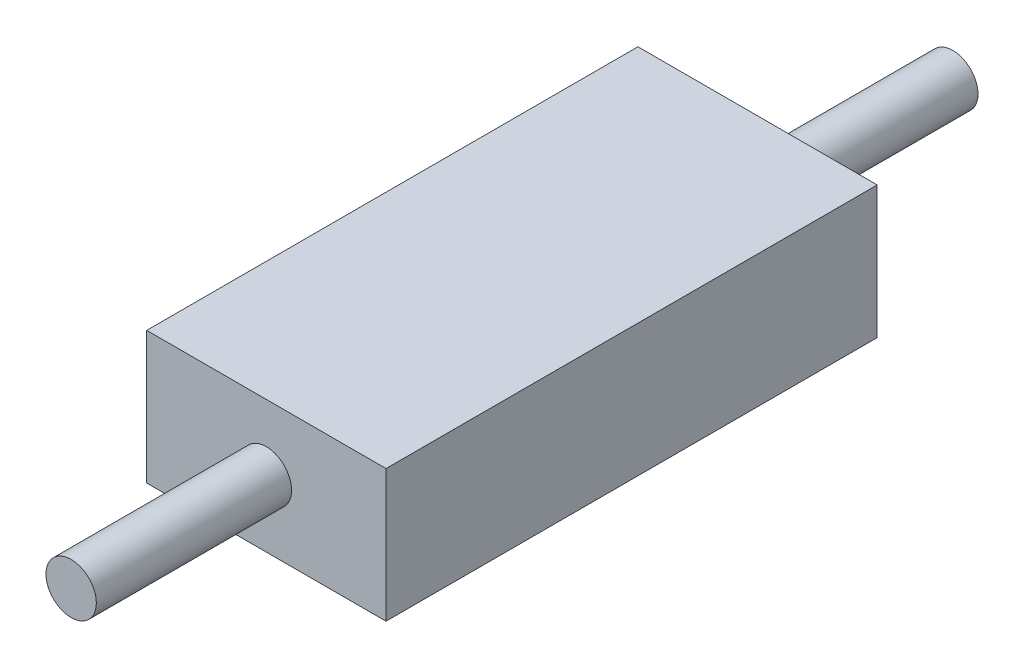
from build123d import *

# Parameters (mm, degrees)
SKETCH1_W           = 38
SKETCH1_H           = 21
BOSS_EXTRUDE1_DEPTH = 78
SKETCH2_R           = 4
CUT_EXTRUDE1_DEPTH  = 81.964498393
SKETCH3_R           = 4
BOSS_EXTRUDE2_DEPTH = 140


with BuildPart() as part:
    # Sketch1 → Boss-Extrude1 (new body)
    with BuildSketch(Plane.XY):
        Rectangle(SKETCH1_W, SKETCH1_H)
    extrude(amount=BOSS_EXTRUDE1_DEPTH)

    # Sketch2 → Cut-Extrude1 (cut, through all)
    with BuildSketch(Plane.XY.offset(78)):
        Circle(SKETCH2_R)
    extrude(amount=-CUT_EXTRUDE1_DEPTH, mode=Mode.SUBTRACT)

    # Sketch3 → Boss-Extrude2 (add)
    with BuildSketch(Plane.XY.offset(109)):
        Circle(SKETCH3_R)
    extrude(amount=-BOSS_EXTRUDE2_DEPTH)


solid = part.part
